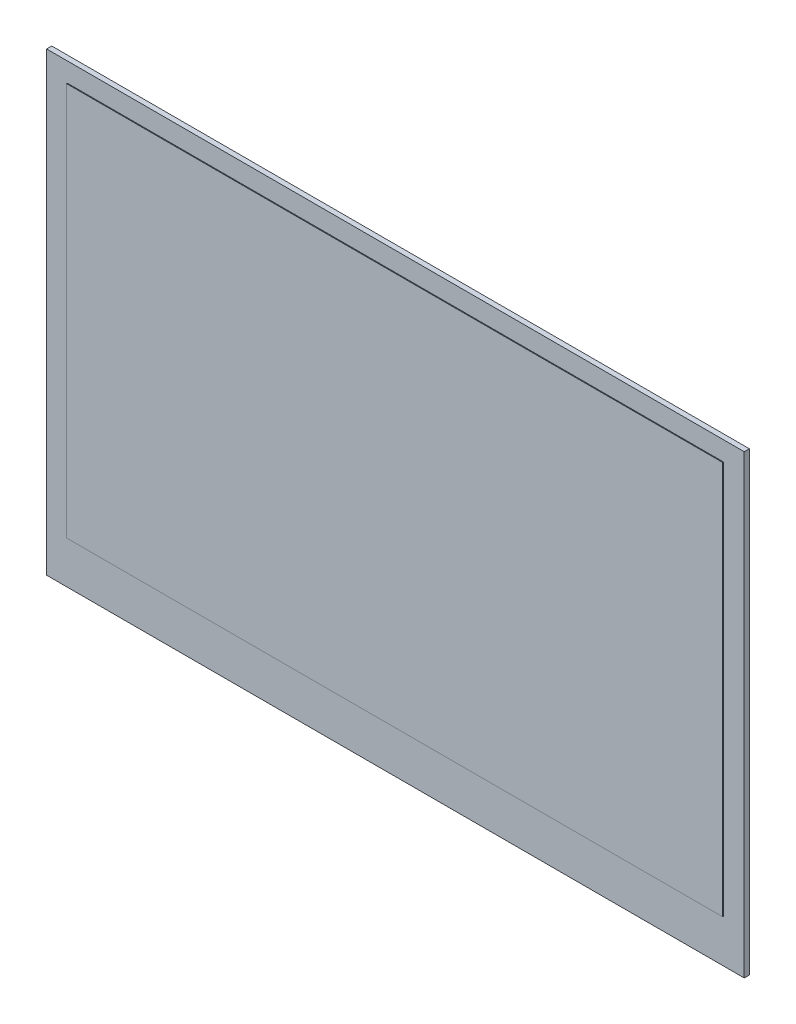
from build123d import *

# Parameters (mm, degrees)
SKETCH_1_W      = 170.2
SKETCH_1_H      = 111.2
EXTRUDE_1_DEPTH = 1.25
SKETCH_2_W      = 160
SKETCH_2_H      = 96
EXTRUDE_2_DEPTH = 0.2


with BuildPart() as part:
    # 草图1 → 凸台-拉伸1 (new body)
    with BuildSketch(Plane.XY):
        Rectangle(SKETCH_1_W, SKETCH_1_H)
    extrude(amount=EXTRUDE_1_DEPTH)

    # 草图2 → 凸台-拉伸2 (add)
    with BuildSketch(Plane.XY.offset(1.25)):
        with Locations((0, 2.9)):
            Rectangle(SKETCH_2_W, SKETCH_2_H)
    extrude(amount=EXTRUDE_2_DEPTH)


solid = part.part
